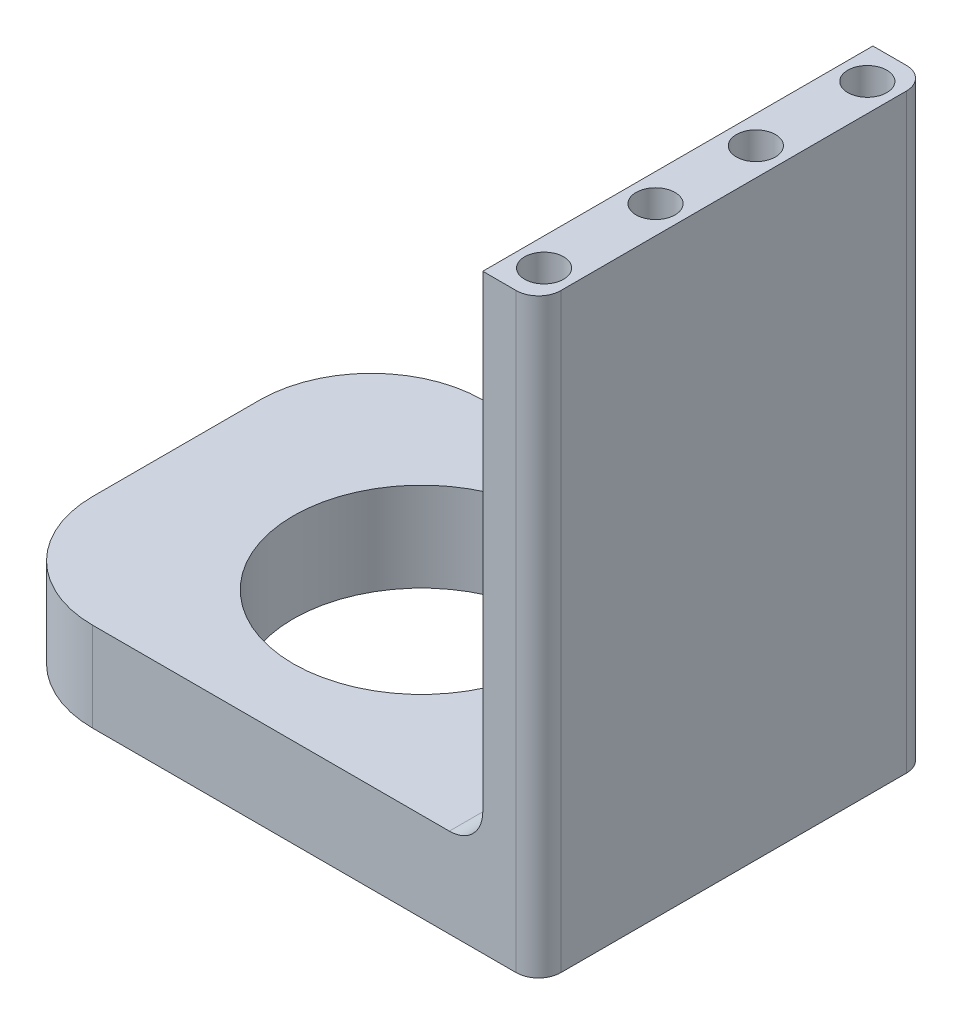
from build123d import *

# Parameters (mm, degrees)
SKETCH1_W           = 50
SKETCH1_H           = 35
SKETCH1_R           = 11.5
BOSS_EXTRUDE1_DEPTH = 8
SKETCH2_W           = 5
SKETCH2_H           = 35
BOSS_EXTRUDE2_DEPTH = 45
FILLET2_R           = 3
SKETCH5_R           = 1.75
CUT_EXTRUDE2_DEPTH  = 10
FILLET3_R           = 10
FILLET4_R           = 2


with BuildPart() as part:
    # Sketch1 → Boss-Extrude1 (new body)
    with BuildSketch(Plane(origin=(0, 0, 0), x_dir=(1, 0, 0), z_dir=(0, 1, 0))):
        with Locations((3, 0)):
            Rectangle(SKETCH1_W, SKETCH1_H)
        with Locations(Location((0, 0, 0), (0, 0, 270))):
            Circle(SKETCH1_R, mode=Mode.SUBTRACT)
    extrude(amount=BOSS_EXTRUDE1_DEPTH)

    # Sketch2 → Boss-Extrude2 (add)
    with BuildSketch(Plane(origin=(0, 8, 0), x_dir=(1, 0, 0), z_dir=(0, 1, 0))):
        with Locations((25.5, 0)):
            Rectangle(SKETCH2_W, SKETCH2_H)
    extrude(amount=BOSS_EXTRUDE2_DEPTH)

    # Fillet2
    fillet2_edges = [part.edges().sort_by_distance(p)[0] for p in [
        (23, 8, 0),
    ]]
    fillet(fillet2_edges, radius=FILLET2_R)

    # Sketch5 → Cut-Extrude2 (cut)
    with BuildSketch(Plane(origin=(0, 53, 0), x_dir=(1, 0, 0), z_dir=(0, 1, 0))):
        with Locations(Location((25.5, 14.5, 0), (0, 0, 270))):
            Circle(SKETCH5_R)
        with Locations(Location((25.5, -14.5, 0), (0, 0, 270))):
            Circle(SKETCH5_R)
        with Locations(Location((25.5, 4.5, 0), (0, 0, 270))):
            Circle(SKETCH5_R)
        with Locations(Location((25.5, -4.5, 0), (0, 0, 270))):
            Circle(SKETCH5_R)
    extrude(amount=-CUT_EXTRUDE2_DEPTH, mode=Mode.SUBTRACT)

    # Fillet3
    fillet3_edges = [part.edges().sort_by_distance(p)[0] for p in [
        (-22, 4, 17.5),
        (-22, 4, -17.5),
    ]]
    fillet(fillet3_edges, radius=FILLET3_R)

    # Fillet4
    fillet4_edges = [part.edges().sort_by_distance(p)[0] for p in [
        (28, 26.5, 17.5),
        (28, 26.5, -17.5),
    ]]
    fillet(fillet4_edges, radius=FILLET4_R)


solid = part.part
